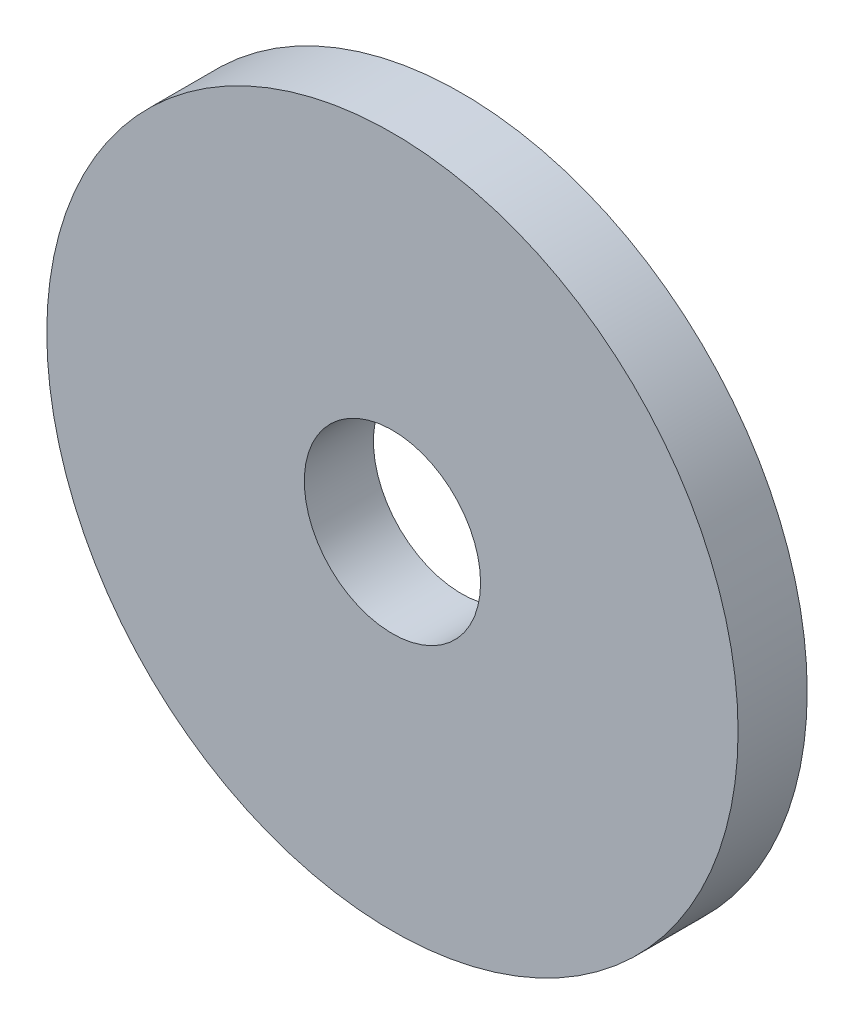
from build123d import *

# Parameters (mm, degrees)
SKETCH1_R           = 10
SKETCH1_R_2         = 2.55
BOSS_EXTRUDE1_DEPTH = 2


with BuildPart() as part:
    # Sketch1 → Boss-Extrude1 (new body)
    with BuildSketch(Plane.XY):
        Circle(SKETCH1_R)
        Circle(SKETCH1_R_2, mode=Mode.SUBTRACT)
    extrude(amount=BOSS_EXTRUDE1_DEPTH)


solid = part.part
